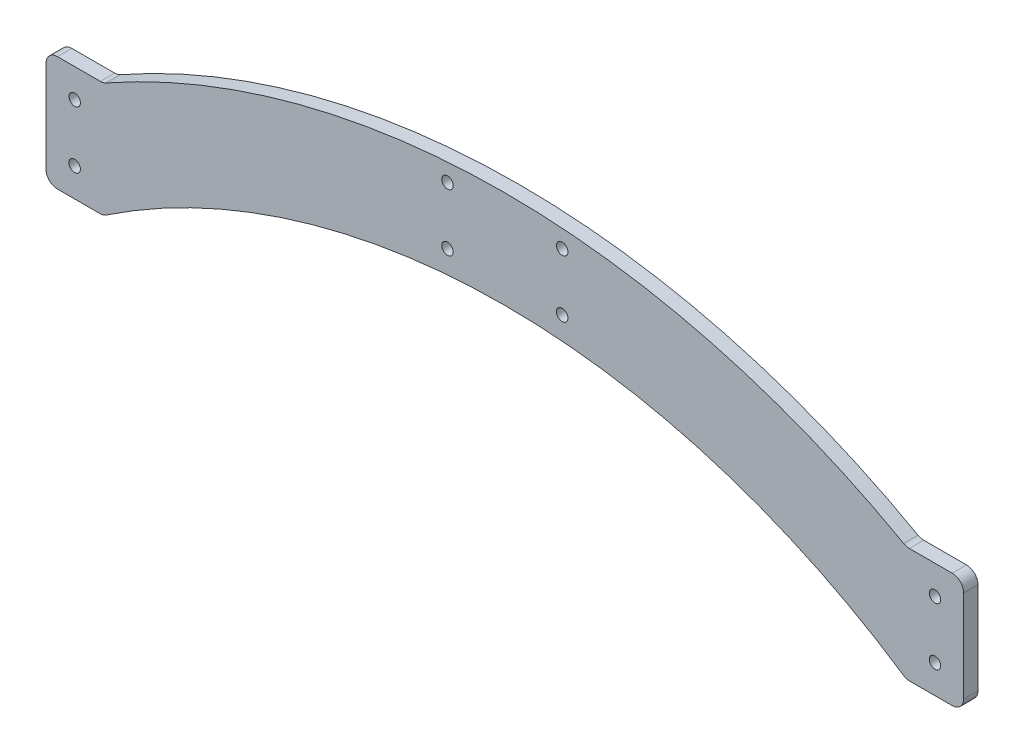
from build123d import *

# Parameters (mm, degrees)
ESQUISSE1_R        = 2
BOSS_EXTRU_1_DEPTH = 5
CONG_1_R           = 4


with BuildPart() as part:
    # Esquisse1 → Boss.-Extru.1 (new body)
    with BuildSketch(Plane.XY):
        with BuildLine():
            Line((160, 0), (160, 40))
            Line((160, 40), (140, 40))
            ThreePointArc((140, 40), (0, 76.901234754), (-140, 40))
            Line((-140, 40), (-160, 40))
            Line((-160, 40), (-160, 0))
            Line((-160, 0), (-140, 0))
            ThreePointArc((-140, 0), (0, 42.876848228), (140, 0))
            Line((140, 0), (160, 0))
        make_face()
        with Locations((20, 70)):
            Circle(ESQUISSE1_R, mode=Mode.SUBTRACT)
        with Locations((20, 50)):
            Circle(ESQUISSE1_R, mode=Mode.SUBTRACT)
        with Locations(Location((-20, 50, 0), (0, 0, 180))):
            Circle(ESQUISSE1_R, mode=Mode.SUBTRACT)
        with Locations(Location((-20, 70, 0), (0, 0, 180))):
            Circle(ESQUISSE1_R, mode=Mode.SUBTRACT)
        with Locations((150, 30)):
            Circle(ESQUISSE1_R, mode=Mode.SUBTRACT)
        with Locations((150, 10)):
            Circle(ESQUISSE1_R, mode=Mode.SUBTRACT)
        with Locations(Location((-150, 10, 0), (0, 0, 180))):
            Circle(ESQUISSE1_R, mode=Mode.SUBTRACT)
        with Locations(Location((-150, 30, 0), (0, 0, 180))):
            Circle(ESQUISSE1_R, mode=Mode.SUBTRACT)
    extrude(amount=BOSS_EXTRU_1_DEPTH)

    # Congé1
    cong_1_edges = [part.edges().sort_by_distance(p)[0] for p in [
        (-140, 0, 2.5),
        (-160, 0, 2.5),
        (-160, 40, 2.5),
        (-140, 40, 2.5),
        (140, 40, 2.5),
        (160, 40, 2.5),
        (160, 0, 2.5),
        (140, 0, 2.5),
    ]]
    fillet(cong_1_edges, radius=CONG_1_R)


solid = part.part
